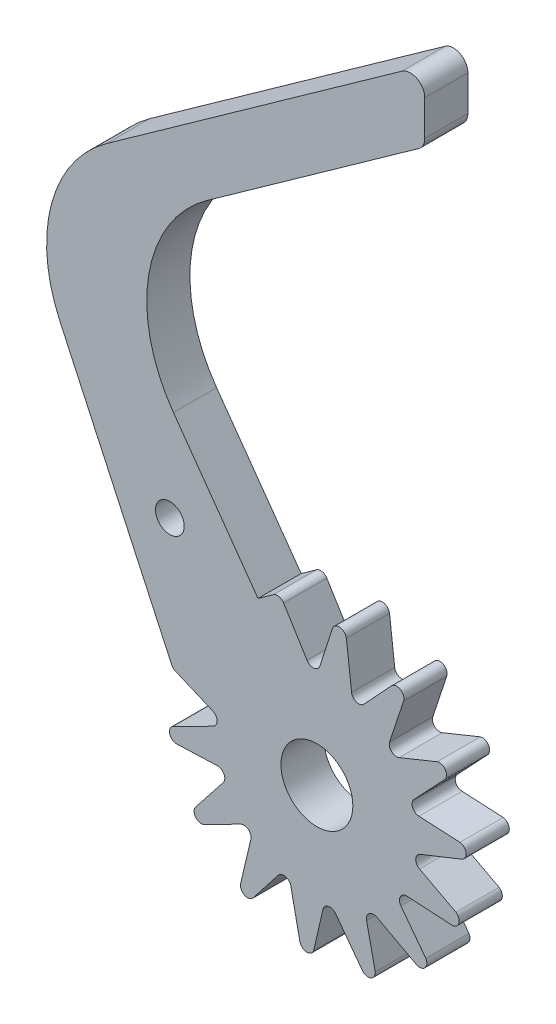
from build123d import *

# Parameters (mm, degrees)
SKETCH1_R           = 2.5
BOSS_EXTRUDE1_DEPTH = 3
FILLET1_R           = 10
FILLET2_R           = 1
SKETCH2_R           = 1
CUT_EXTRUDE1_DEPTH  = 5


with BuildPart() as part:
    # Sketch1 → Boss-Extrude1 (new body)
    with BuildSketch(Plane.XY):
        with BuildLine():
            Line((-15.775199063, 25.595763214), (7.5, 42.17358061))
            Line((7.5, 42.17358061), (7.5, 47.084472248))
            Line((7.5, 47.084472248), (-21.353827366, 26.533263214))
            Line((-21.353827366, 26.533263214), (-10.092955814, 2.19356054))
            ThreePointArc((-10.092955814, 2.19356054), (-10.003238503, 2.060792281), (-9.876128914, 1.963223028))
            Line((-9.876128914, 1.963223028), (-7.240482475, 0.850547008))
            ThreePointArc((-7.240482475, 0.850547008), (-6.935224137, 0.406591519), (-7.210200963, -0.056730047))
            Line((-7.210200963, -0.056730047), (-9.9765648, -1.448728989))
            ThreePointArc((-9.9765648, -1.448728989), (-10.241411893, -1.996858986), (-9.780506444, -2.394548117))
            Line((-9.780506444, -2.394548117), (-6.921562347, -2.289102741))
            ThreePointArc((-6.921562347, -2.289102741), (-6.457280642, -2.56245531), (-6.510686125, -3.098577481))
            Line((-6.510686125, -3.098577481), (-8.429579039, -5.529272837))
            ThreePointArc((-8.429579039, -5.529272837), (-8.437962276, -6.137976541), (-7.852169389, -6.303618237))
            Line((-7.852169389, -6.303618237), (-5.305649232, -4.999810287))
            ThreePointArc((-5.305649232, -4.999810287), (-4.76934332, -5.051337921), (-4.591170105, -5.559799752))
            Line((-4.591170105, -5.559799752), (-5.303021449, -8.57371707))
            ThreePointArc((-5.303021449, -8.57371707), (-5.053369941, -9.128932885), (-4.45245808, -9.031488473))
            Line((-4.45245808, -9.031488473), (-2.695540082, -6.773631253))
            ThreePointArc((-2.695540082, -6.773631253), (-2.187705338, -6.593678477), (-1.811340311, -6.979202139))
            Line((-1.811340311, -6.979202139), (-1.182760229, -10.011580251))
            ThreePointArc((-1.182760229, -10.011580251), (-0.721854781, -10.409269381), (-0.21842547, -10.066998426))
            Line((-0.21842547, -10.066998426), (0.419671299, -7.278179214))
            ThreePointArc((0.419671299, -7.278179214), (0.803874553, -6.900466376), (1.307906448, -7.09081074))
            Line((1.307906448, -7.09081074), (3.159131837, -9.573429214))
            ThreePointArc((3.159131837, -9.573429214), (3.744924723, -9.73907091), (4.056536671, -9.216109658))
            Line((4.056536671, -9.216109658), (3.456242815, -6.418909742))
            ThreePointArc((3.456242815, -6.418909742), (3.644820872, -5.914214344), (4.182071907, -5.87371184))
            Line((4.182071907, -5.87371184), (6.909051797, -7.34136664))
            ThreePointArc((6.909051797, -7.34136664), (7.509963658, -7.243922228), (7.571367017, -6.638265473))
            Line((7.571367017, -6.638265473), (5.845168255, -4.356836553))
            ThreePointArc((5.845168255, -4.356836553), (5.802784524, -3.819730653), (6.272582224, -3.55597082))
            Line((6.272582224, -3.55597082), (9.364323053, -3.733646292))
            ThreePointArc((9.364323053, -3.733646292), (9.867752363, -3.391375337), (9.667441101, -2.816513723))
            Line((9.667441101, -2.816513723), (7.138800197, -1.478360048))
            ThreePointArc((7.138800197, -1.478360048), (6.87339673, -1.009488927), (7.187708321, -0.571896249))
            Line((7.187708321, -0.571896249), (10.064866009, 0.573701222))
            ThreePointArc((10.064866009, 0.573701222), (10.376477957, 1.096662475), (9.951987284, 1.533008835))
            Line((9.951987284, 1.533008835), (7.094732162, 1.677138107))
            ThreePointArc((7.094732162, 1.677138107), (6.656041435, 1.989915303), (6.75596982, 2.519342773))
            Line((6.75596982, 2.519342773), (8.879409827, 4.773546063))
            ThreePointArc((8.879409827, 4.773546063), (8.940813186, 5.379202818), (8.371686043, 5.595269411))
            Line((8.371686043, 5.595269411), (5.721221814, 4.5183667))
            ThreePointArc((5.721221814, 4.5183667), (5.191447637, 4.616440396), (5.058267794, 5.138496195))
            Line((5.058267794, 5.138496195), (6.030090531, 8.078902715))
            ThreePointArc((6.030090531, 8.078902715), (5.829779269, 8.653764329), (5.222661219, 8.609063642))
            Line((5.222661219, 8.609063642), (3.275643601, 6.512923743))
            ThreePointArc((3.275643601, 6.512923743), (2.754057404, 6.377916456), (2.41272516, 6.794775458))
            Line((2.41272516, 6.794775458), (2.050826183, 9.870398819))
            ThreePointArc((2.050826183, 9.870398819), (1.62633551, 10.306745179), (1.09499102, 10.009653423))
            Line((1.09499102, 10.009653423), (0.216260792, 7.287060309))
            ThreePointArc((0.216260792, 7.287060309), (-0.199400295, 6.944270302), (-0.684924592, 7.177819622))
            Line((-0.684924592, 7.177819622), (-2.312731053, 9.812335907))
            ThreePointArc((-2.312731053, 9.812335907), (-2.639135445, 10.039629661), (-3.028156876, 9.956776757))
            Line((-3.028156876, 9.956776757), (-4.095052713, 9.19687759))
            Line((-4.095052713, 9.19687759), (-15.775199063, 25.595763214))
        make_face()
        Circle(SKETCH1_R, mode=Mode.SUBTRACT)
    extrude(amount=BOSS_EXTRUDE1_DEPTH)

    # Fillet1
    fillet1_edges = [part.edges().sort_by_distance(p)[0] for p in [
        (-21.353827366, 26.533263214, 1.5),
        (-15.775199063, 25.595763214, 1.5),
    ]]
    fillet(fillet1_edges, radius=FILLET1_R)

    # Fillet2
    fillet2_edges = [part.edges().sort_by_distance(p)[0] for p in [
        (7.5, 47.084472248, 1.5),
        (7.5, 42.17358061, 1.5),
    ]]
    fillet(fillet2_edges, radius=FILLET2_R)

    # Sketch2 → Cut-Extrude1 (cut)
    with BuildSketch(Plane.XY.offset(3)):
        with Locations((-10.224511364, 10.975398278)):
            Circle(SKETCH2_R)
    extrude(amount=-CUT_EXTRUDE1_DEPTH, mode=Mode.SUBTRACT)


solid = part.part
